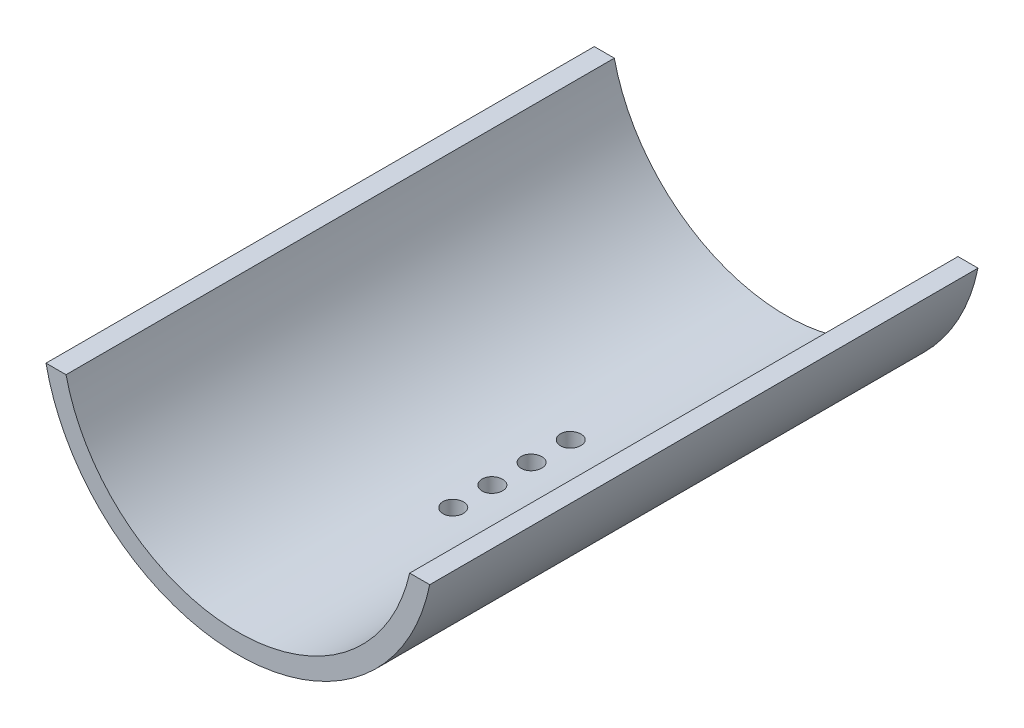
from build123d import *

# Parameters (mm, degrees)
SKETCH2_W          = 177.8
SKETCH2_H          = 6.35
REVOLVE1_ANGLE     = 180
SKETCH3_R          = 3.327499949
CUT_EXTRUDE1_DEPTH = 175.339362144
CUT_EXTRUDE2_DEPTH = 200.191716848


with BuildPart() as part:
    # Sketch2 → Revolve1 (revolve)
    with BuildSketch(Plane(origin=(0, 0, 0), x_dir=(0, 0, -1), z_dir=(0, -1, 0))):
        with Locations((60.53129924, -60.325)):
            Rectangle(SKETCH2_W, SKETCH2_H)
    revolve(axis=Axis((0, 0, 0), (0, 0, 1)), revolution_arc=REVOLVE1_ANGLE)

    # Sketch3 → Cut-Extrude1 (cut, through all)
    with BuildSketch(Plane(origin=(0, 0, 0), x_dir=(1, 0, 0), z_dir=(0, 1, 0))):
        with Locations(Location((0, 66.88129924, 0), (0, 0, 270))):
            Circle(SKETCH3_R)
        with Locations(Location((0, 54.18129924, 0), (0, 0, 270))):
            Circle(SKETCH3_R)
        with Locations(Location((0, 79.58129924, 0), (0, 0, 270))):
            Circle(SKETCH3_R)
        with Locations(Location((0, 41.48129924, 0), (0, 0, 270))):
            Circle(SKETCH3_R)
    extrude(amount=-CUT_EXTRUDE1_DEPTH, mode=Mode.SUBTRACT)

    # Sketch4 → Cut-Extrude2 (cut, through all)
    with BuildSketch(Plane.XY.offset(28.36870076)):
        with BuildLine():
            Line((-81.567226875, -12.7), (81.567226875, -12.7))
            ThreePointArc((81.567226875, -12.7), (0, 82.55), (-81.567226875, -12.7))
        make_face()
    extrude(amount=-CUT_EXTRUDE2_DEPTH, mode=Mode.SUBTRACT)


solid = part.part
